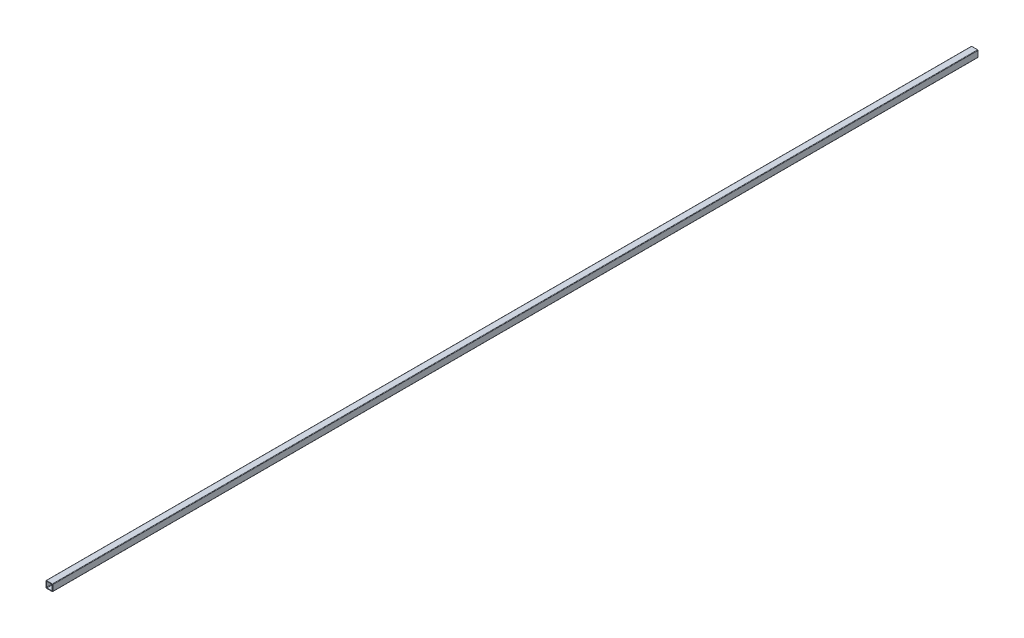
from build123d import *

# Parameters (mm, degrees)
BOSS_EXTRUDE1_DEPTH = 5243.80000006
FILLET1_R           = 1


with BuildPart() as part:
    # Sketch1 → Boss-Extrude1 (new body)
    with BuildSketch(Plane.XY):
        with BuildLine():
            Line((2.54, 0), (35.56, 0))
            ThreePointArc((35.56, 0), (37.356051224, -0.743948776), (38.1, -2.54))
            Line((38.1, -2.54), (38.1, -35.56))
            ThreePointArc((38.1, -35.56), (37.356051224, -37.356051224), (35.56, -38.1))
            Line((35.56, -38.1), (2.54, -38.1))
            ThreePointArc((2.54, -38.1), (0.743948776, -37.356051224), (0, -35.56))
            Line((0, -35.56), (0, -2.54))
            ThreePointArc((0, -2.54), (0.743948776, -0.743948776), (2.54, 0))
        make_face()
        with BuildLine():
            Line((5.3086, -2.7686), (32.7914, -2.7686))
            ThreePointArc((32.7914, -2.7686), (34.587451224, -3.512548776), (35.3314, -5.3086))
            Line((35.3314, -5.3086), (35.3314, -32.7914))
            ThreePointArc((35.3314, -32.7914), (34.587451224, -34.587451224), (32.7914, -35.3314))
            Line((32.7914, -35.3314), (5.3086, -35.3314))
            ThreePointArc((5.3086, -35.3314), (3.512548776, -34.587451224), (2.7686, -32.7914))
            Line((2.7686, -32.7914), (2.7686, -5.3086))
            ThreePointArc((2.7686, -5.3086), (3.512548776, -3.512548776), (5.3086, -2.7686))
        make_face(mode=Mode.SUBTRACT)
    extrude(amount=BOSS_EXTRUDE1_DEPTH)

    # Fillet1
    fillet1_edges = [part.edges().sort_by_distance(p)[0] for p in [
        (37.356051224, -37.356051224, 5243.80000006),
        (19.05, -38.1, 0),
        (0.743948776, -37.356051224, 0),
        (38.1, -19.05, 5243.80000006),
        (37.356051224, -0.743948776, 5243.80000006),
        (19.05, 0, 5243.80000006),
        (0.743948776, -0.743948776, 5243.80000006),
        (0, -19.05, 5243.80000006),
        (3.512548776, -34.587451224, 0),
        (19.05, -35.3314, 0),
        (34.587451224, -34.587451224, 0),
        (35.3314, -19.05, 0),
        (34.587451224, -3.512548776, 0),
        (19.05, -2.7686, 0),
        (3.512548776, -3.512548776, 0),
        (2.7686, -19.05, 0),
        (3.512548776, -34.587451224, 5243.80000006),
        (19.05, -35.3314, 5243.80000006),
        (34.587451224, -34.587451224, 5243.80000006),
        (35.3314, -19.05, 5243.80000006),
        (34.587451224, -3.512548776, 5243.80000006),
        (19.05, -2.7686, 5243.80000006),
        (3.512548776, -3.512548776, 5243.80000006),
        (2.7686, -19.05, 5243.80000006),
        (0.743948776, -37.356051224, 5243.80000006),
        (19.05, -38.1, 5243.80000006),
        (0, -19.05, 0),
        (0.743948776, -0.743948776, 0),
        (19.05, 0, 0),
        (37.356051224, -0.743948776, 0),
        (38.1, -19.05, 0),
        (37.356051224, -37.356051224, 0),
    ]]
    fillet(fillet1_edges, radius=FILLET1_R)


solid = part.part
